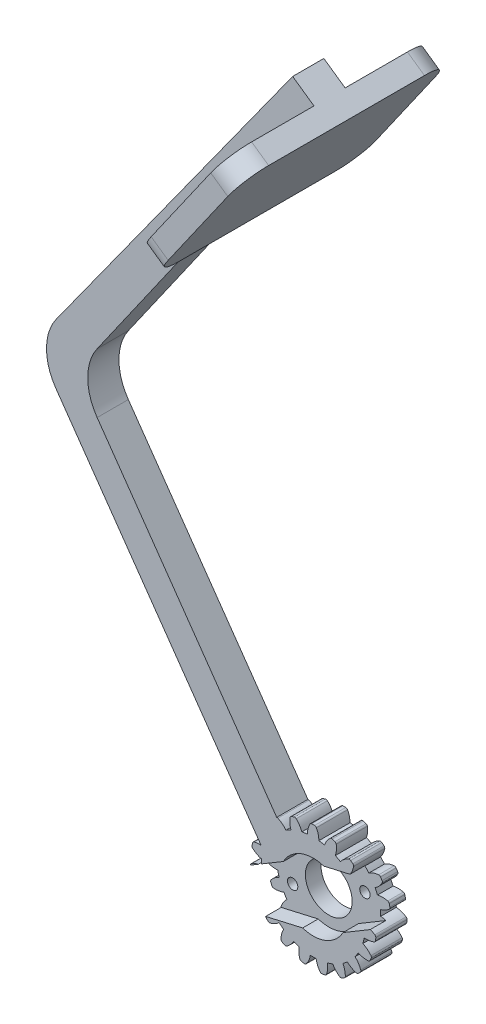
from build123d import *

# Parameters (mm, degrees)
SKETCH1_R                = 1.5
BOSS_EXTRUDE1_DEPTH      = 6
CIRPATTERN1_COUNT        = 19
BOSS_EXTRUDE2_DEPTH      = 6
CUT_EXTRUDE1_START       = -3
SKETCH4_R                = 1.5
CUT_EXTRUDE1_DEPTH       = 3
CUT_EXTRUDE2_DEPTH       = 145.398161391
CUT_EXTRUDE2_DEPTH_BACK  = 145.398161391
SKETCH5_R                = 4.5
CUT_EXTRUDE3_DEPTH       = 145.304639609
CUT_EXTRUDE3_DEPTH_BACK  = 145.304639609
SKETCH6_R                = 1
BOSS_EXTRUDE3_DEPTH      = 3
BOSS_EXTRUDE3_DEPTH_BACK = 1


with BuildPart() as part:
    # Sketch1 → Boss-Extrude1 (new body)
    with BuildSketch(Plane.XY):
        with BuildLine():
            ThreePointArc((-1.1, 9.939315872), (0, -10), (1.1, 9.939315872))
            add(Edge.make_bspline(
                [(0.617746857, 11.864626423), (0.963605173, 11.235441628), (1.059124761, 10.632766051), (1.1, 9.939315872)],
                knots=[0.104246354, 0.104246354, 0.104246354, 0.104246354, 1, 1, 1, 1], degree=3))
            ThreePointArc((0.617746857, 11.864626423), (0.474766739, 12.013880626), (0.276370143, 12.071836834))
            ThreePointArc((0.276370143, 12.071836834), (0, 12.075), (-0.276370142, 12.071836834))
            ThreePointArc((-0.276370142, 12.071836834), (-0.474766738, 12.013880627), (-0.617746856, 11.864626423))
            add(Edge.make_bspline(
                [(-0.617746856, 11.864626423), (-0.934550755, 11.28829737), (-1.120724213, 10.60048866), (-1.1, 9.939315872)],
                knots=[0.104246354, 0.104246354, 0.104246354, 0.104246354, 1, 1, 1, 1], degree=3))
        make_face()
        Circle(SKETCH1_R, mode=Mode.SUBTRACT)
    boss_extrude1 = extrude(amount=BOSS_EXTRUDE1_DEPTH)

    # CirPattern1: Boss-Extrude1 ×19 about axis
    cirpattern1_axis = Axis((0, 0, 6), (0, 0, -1))
    for i in range(1, CIRPATTERN1_COUNT):
        add(boss_extrude1.rotate(cirpattern1_axis, i * 360 / CIRPATTERN1_COUNT))

    # Sketch2 → Boss-Extrude2 (add)
    with BuildSketch(Plane.XY.offset(6)):
        with BuildLine():
            Line((-2.585087734, 3.441458618), (-41.587095016, 59.142097576))
            ThreePointArc((-41.587095016, 59.142097576), (-43.395574573, 64.87786194), (-41.587095016, 70.613626303))
            Line((-41.587095016, 70.613626303), (0.967794932, 131.38830756))
            Line((0.967794932, 131.38830756), (-3.947117333, 134.829766178))
            Line((-3.947117333, 134.829766178), (-49.455848564, 71.604451096))
            ThreePointArc((-49.455848564, 71.604451096), (-51.339471936, 65.827630501), (-49.531204188, 60.026780482))
            Line((-49.531204188, 60.026780482), (-7.5, 0))
            Line((-7.5, 0), (-2.585087734, 3.441458618))
        make_face()
    extrude(amount=-BOSS_EXTRUDE2_DEPTH)

    # Sketch4 → Cut-Extrude1 (cut)
    with BuildSketch(Plane.XY.offset(6).offset(CUT_EXTRUDE1_START)):
        with BuildLine():
            ThreePointArc((-2.034530077, -6.173385405), (2.420414621, -6.032544493), (5.737256394, -3.055141415))
            Line((5.737256394, -3.055141415), (10.989669758, 0.075054714))
            add(Edge.make_bspline(
                [(10.989669758, 0.075054714), (10.66744888, 0.187695941), (10.330615167, 0.258277336), (9.996205349, 0.275460743)],
                knots=[0.546568193, 0.546568193, 0.546568193, 0.546568193, 1, 1, 1, 1], degree=3))
            ThreePointArc((9.996205349, 0.275460743), (9.96584493, 0.825793455), (9.905209485, 1.373617506))
            add(Edge.make_bspline(
                [(11.653219898, 2.31374963), (11.128191187, 1.82401875), (10.567405996, 1.583473928), (9.905209485, 1.373617506)],
                knots=[0.104246354, 0.104246354, 0.104246354, 0.104246354, 1, 1, 1, 1], degree=3))
            ThreePointArc((11.653219898, 2.31374963), (11.762807418, 2.488994335), (11.770286696, 2.695547456))
            ThreePointArc((11.770286696, 2.695547456), (11.705508211, 2.964237257), (11.634596978, 3.231374035))
            ThreePointArc((11.634596978, 3.231374035), (11.52971073, 3.409472341), (11.349924122, 3.511437564))
            add(Edge.make_bspline(
                [(11.349924122, 3.511437564), (10.713459826, 3.677066929), (10.000994996, 3.688696473), (9.365141414, 3.506298091)],
                knots=[0.104246354, 0.104246354, 0.104246354, 0.104246354, 1, 1, 1, 1], degree=3))
            ThreePointArc((9.365141414, 3.506298091), (9.157733267, 4.016954247), (8.922505039, 4.515407383))
            add(Edge.make_bspline(
                [(10.270543024, 5.972178608), (9.932977174, 5.338506155), (9.480681647, 4.928908061), (8.922505039, 4.515407383)],
                knots=[0.104246354, 0.104246354, 0.104246354, 0.104246354, 1, 1, 1, 1], degree=3))
            ThreePointArc((10.270543024, 5.972178608), (10.317290928, 6.173511082), (10.257297269, 6.371301102))
            ThreePointArc((10.257297269, 6.371301102), (10.108785225, 6.604399009), (9.954976988, 6.83403674))
            ThreePointArc((9.954976988, 6.83403674), (9.797945341, 6.968428679), (9.594792013, 7.006492529))
            add(Edge.make_bspline(
                [(9.594792013, 7.006492529), (8.939033341, 6.956488019), (8.261395715, 6.73615049), (7.719219091, 6.357173635)],
                knots=[0.104246354, 0.104246354, 0.104246354, 0.104246354, 1, 1, 1, 1], degree=3))
            ThreePointArc((7.719219091, 6.357173635), (7.357239107, 6.772815716), (6.972908724, 7.167882806))
            add(Edge.make_bspline(
                [(7.084072765, 7.332751711), (7.04798882, 7.278022576), (7.010909437, 7.223130061), (6.972908724, 7.167882806)],
                knots=[0.913533389, 0.913533389, 0.913533389, 0.913533389, 1, 1, 1, 1], degree=3))
            Line((7.084072765, 7.332751711), (2.034530077, 6.173385405))
            ThreePointArc((2.034530077, 6.173385405), (-2.420414621, 6.032544493), (-5.737256394, 3.055141415))
            Line((-5.737256394, 3.055141415), (-9.986319648, 0.522895679))
            ThreePointArc((-9.986319648, 0.522895679), (-9.992028439, 0.399208812), (-9.996205349, 0.275460743))
            add(Edge.make_bspline(
                [(-10.57273532, 0.173418983), (-10.386903226, 0.214702242), (-10.195544231, 0.247054329), (-9.996205349, 0.275460743)],
                knots=[0.740356392, 0.740356392, 0.740356392, 0.740356392, 1, 1, 1, 1], degree=3))
            Line((-10.57273532, 0.173418983), (-12.053969281, -0.709328145))
            ThreePointArc((-12.053969281, -0.709328145), (-12.053744598, -0.71539522), (-12.053427856, -0.721458186))
            ThreePointArc((-12.053427856, -0.721458186), (-12.033757753, -0.997145596), (-12.007782925, -1.272310582))
            ThreePointArc((-12.007782925, -1.272310582), (-11.933641207, -1.465243568), (-11.773089577, -1.595410022))
            add(Edge.make_bspline(
                [(-11.773089577, -1.595410022), (-11.172567522, -1.863538998), (-10.471733944, -1.992277787), (-9.814530789, -1.917025141)],
                knots=[0.104246354, 0.104246354, 0.104246354, 0.104246354, 1, 1, 1, 1], degree=3))
            ThreePointArc((-9.814530789, -1.917025141), (-9.694002659, -2.454854871), (-9.544025328, -2.985227051))
            add(Edge.make_bspline(
                [(-11.113454495, -4.200250055), (-10.676193545, -3.630781581), (-10.162649109, -3.301215268), (-9.544025328, -2.985227051)],
                knots=[0.104246354, 0.104246354, 0.104246354, 0.104246354, 1, 1, 1, 1], degree=3))
            ThreePointArc((-11.113454495, -4.200250055), (-11.192703054, -4.391142164), (-11.166082798, -4.596109218))
            ThreePointArc((-11.166082798, -4.596109218), (-11.057962919, -4.850472252), (-10.944049555, -5.102294028))
            ThreePointArc((-10.944049555, -5.102294028), (-10.811279801, -5.260699595), (-10.617162323, -5.331682243))
            add(Edge.make_bspline(
                [(-10.617162323, -5.331682243), (-9.962116873, -5.390294059), (-9.257454975, -5.284497135), (-8.660295394, -4.999928369)],
                knots=[0.104246354, 0.104246354, 0.104246354, 0.104246354, 1, 1, 1, 1], degree=3))
            ThreePointArc((-8.660295394, -4.999928369), (-8.371664783, -5.469481581), (-8.057602071, -5.922419173))
            add(Edge.make_bspline(
                [(-8.057602071, -5.922419173), (-8.540105904, -6.422153091), (-8.918815079, -6.900610197), (-9.147477913, -7.581201697)],
                knots=[0.249403928, 0.249403928, 0.249403928, 0.249403928, 1.145157574, 1.145157574, 1.145157574, 1.145157574], degree=3))
            ThreePointArc((-9.147477913, -7.581201697), (-9.168047244, -7.694199594), (-9.155658882, -7.808384316))
            Line((-9.155658882, -7.808384316), (-2.034530077, -6.173385405))
        make_face()
        Circle(SKETCH4_R, mode=Mode.SUBTRACT)
    extrude(amount=CUT_EXTRUDE1_DEPTH, mode=Mode.SUBTRACT)

    # Sketch5 → Cut-Extrude2 (cut, two sides: drawn at the far end of the back side and taken through both)
    with BuildSketch(Plane(origin=(0, 0, 0), x_dir=(-1, 0, 0), z_dir=(0, 0, -1)).offset(-CUT_EXTRUDE2_DEPTH_BACK)):
        with Locations(Location((0, 0, 0), (0, 0, 180))):
            Circle(SKETCH5_R)
    extrude(amount=CUT_EXTRUDE2_DEPTH + CUT_EXTRUDE2_DEPTH_BACK, mode=Mode.SUBTRACT)

    # Sketch6 → Cut-Extrude3 (cut, two sides: drawn at the far end of the back side and taken through both)
    with BuildSketch(Plane.XY.offset(3).offset(-CUT_EXTRUDE3_DEPTH_BACK)):
        with Locations((-6.960628261, -2.792786102)):
            Circle(SKETCH6_R)
        with Locations((6.960628261, 2.792786102)):
            Circle(SKETCH6_R)
    extrude(amount=CUT_EXTRUDE3_DEPTH + CUT_EXTRUDE3_DEPTH_BACK, mode=Mode.SUBTRACT)

    # Sketch7 → Boss-Extrude3 (add, two sides: drawn at the far end of the back side and taken through both)
    with BuildSketch(Plane(origin=(-61.082911389, 42.77071501, 0), x_dir=(0, 0, -1), z_dir=(0.819152044288991, -0.5735764363510473, 0)).offset(-BOSS_EXTRUDE3_DEPTH_BACK)):
        with BuildLine():
            Line((-18, 78.182105102), (12, 78.182105102))
            ThreePointArc((12, 78.182105102), (15.535533906, 79.646571196), (17, 83.182105102))
            Line((17, 83.182105102), (17, 103.182105102))
            ThreePointArc((17, 103.182105102), (15.535533906, 106.717639008), (12, 108.182105102))
            Line((12, 108.182105102), (-18, 108.182105102))
            ThreePointArc((-18, 108.182105102), (-21.535533906, 106.717639008), (-23, 103.182105102))
            Line((-23, 103.182105102), (-23, 83.182105102))
            ThreePointArc((-23, 83.182105102), (-21.535533906, 79.646571196), (-18, 78.182105102))
        make_face()
    extrude(amount=BOSS_EXTRUDE3_DEPTH + BOSS_EXTRUDE3_DEPTH_BACK)


solid = part.part
